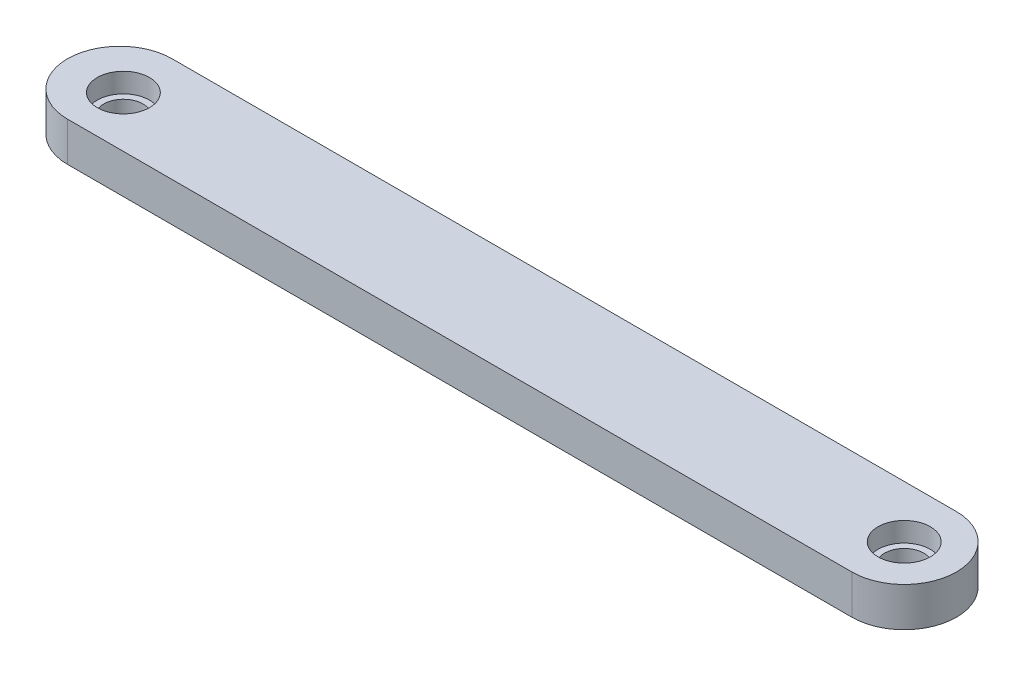
from build123d import *

# Parameters (mm, degrees)
SKETCH1_R           = 3
BOSS_EXTRUDE1_DEPTH = 6
SKETCH3_R           = 4
CUT_EXTRUDE1_DEPTH  = 3


with BuildPart() as part:
    # Sketch1 → Boss-Extrude1 (new body)
    with BuildSketch(Plane(origin=(0, 0, 0), x_dir=(1, 0, 0), z_dir=(0, 1, 0))):
        with BuildLine():
            Line((-60, -8), (60, -8))
            ThreePointArc((60, -8), (68, 0), (60, 8))
            Line((60, 8), (-60, 8))
            ThreePointArc((-60, 8), (-68, 0), (-60, -8))
        make_face()
        with Locations(Location((-59.243309237, -0.211557176, 0), (0, 0, 270))):
            Circle(SKETCH1_R, mode=Mode.SUBTRACT)
        with Locations(Location((60, 0, 0), (0, 0, 270))):
            Circle(SKETCH1_R, mode=Mode.SUBTRACT)
    extrude(amount=BOSS_EXTRUDE1_DEPTH)

    # Sketch3 → Cut-Extrude1 (cut)
    with BuildSketch(Plane(origin=(0, 6, 0), x_dir=(1, 0, 0), z_dir=(0, 1, 0))):
        with Locations(Location((-59.243309237, -0.211557176, 0), (0, 0, 270))):
            Circle(SKETCH3_R)
        with Locations(Location((60, 0, 0), (0, 0, 270))):
            Circle(SKETCH3_R)
    extrude(amount=-CUT_EXTRUDE1_DEPTH, mode=Mode.SUBTRACT)


solid = part.part
